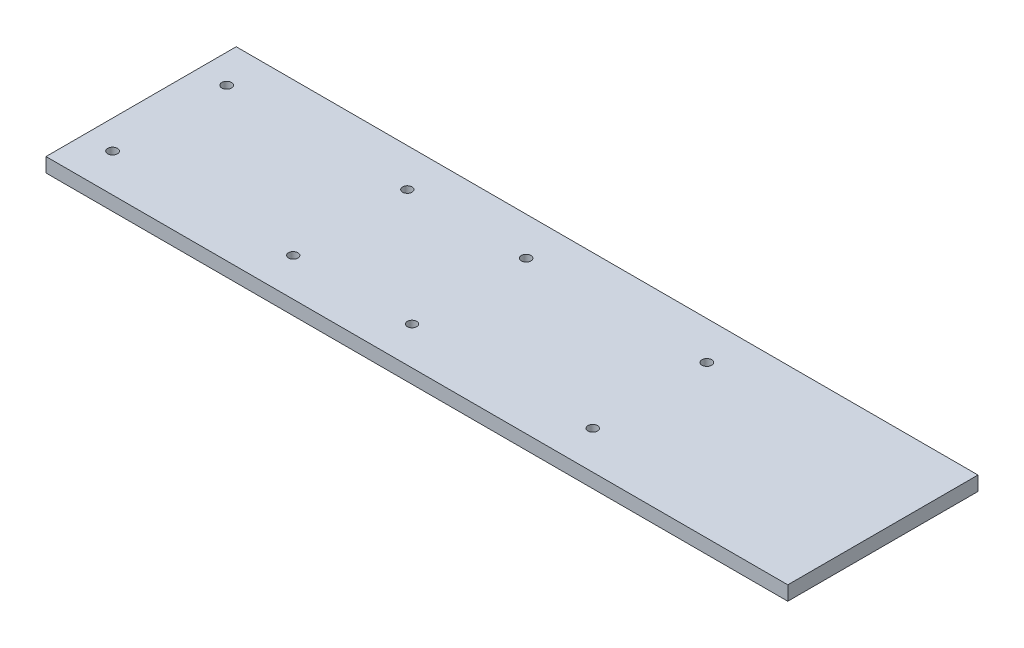
from build123d import *

# Parameters (mm, degrees)
SKETCH1_W           = 990.6
SKETCH1_H           = 254
BOSS_EXTRUDE1_DEPTH = 19.05
SKETCH2_R           = 6.469787118
SKETCH2_R_2         = 6.473657786
SKETCH2_R_3         = 6.271584958
SKETCH2_R_4         = 6.243422097
SKETCH2_R_5         = 6.398217523
SKETCH2_R_6         = 6.271582896
SKETCH2_R_7         = 6.370696496
SKETCH2_R_8         = 6.474667208
CUT_EXTRUDE1_DEPTH  = 19.05


with BuildPart() as part:
    # Sketch1 → Boss-Extrude1 (new body)
    with BuildSketch(Plane(origin=(0, 0, 0), x_dir=(1, 0, 0), z_dir=(0, 1, 0))):
        with Locations((495.3, -127)):
            Rectangle(SKETCH1_W, SKETCH1_H)
    extrude(amount=BOSS_EXTRUDE1_DEPTH)

    # Sketch2 → Cut-Extrude1 (cut)
    with BuildSketch(Plane(origin=(0, 19.05, 0), x_dir=(1, 0, 0), z_dir=(0, 1, 0))):
        with Locations(Location((38.163282765, -203.266202911, 0), (0, 0, 270))):
            Circle(SKETCH2_R)
        with Locations(Location((38.163282765, -50.93682379, 0), (0, 0, 270))):
            Circle(SKETCH2_R_2)
        with Locations(Location((279.419639976, -203.266202911, 0), (0, 0, 270))):
            Circle(SKETCH2_R_3)
        with Locations(Location((279.419639976, -50.93682379, 0), (0, 0, 270))):
            Circle(SKETCH2_R_4)
        with Locations(Location((438.126610422, -50.93682379, 0), (0, 0, 270))):
            Circle(SKETCH2_R_5)
        with Locations(Location((438.126610422, -203.266202911, 0), (0, 0, 270))):
            Circle(SKETCH2_R_6)
        with Locations(Location((679.376061379, -203.266202911, 0), (0, 0, 270))):
            Circle(SKETCH2_R_7)
        with Locations(Location((679.376061379, -50.93682379, 0), (0, 0, 270))):
            Circle(SKETCH2_R_8)
    extrude(amount=-CUT_EXTRUDE1_DEPTH, mode=Mode.SUBTRACT)


solid = part.part
